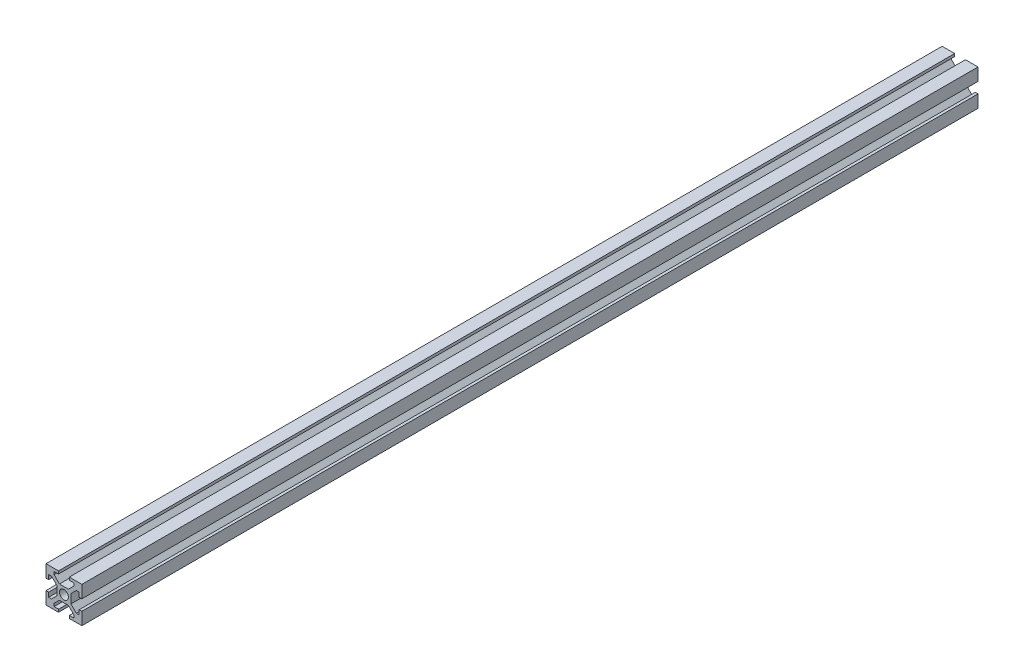
from build123d import *

# Parameters (mm, degrees)
SKETCH1_R           = 2.5
BOSS_EXTRUDE1_DEPTH = 500


with BuildPart() as part:
    # Sketch1 → Boss-Extrude1 (new body)
    with BuildSketch(Plane.XY):
        Polygon((-10, 3), (-10, 10), (-3, 10), (-3, 8.5), (-5.5, 8.5), (-5.5, 6.914213562), (-2.5, 3.914213562), (2.5, 3.914213562), (5.5, 6.914213562), (5.5, 8.5), (3, 8.5), (3, 10), (10, 10), (10, 3), (8.5, 3), (8.5, 5.5), (6.914213562, 5.5), (3.914213562, 2.5), (3.914213562, -2.5), (6.914213562, -5.5), (8.5, -5.5), (8.5, -3), (10, -3), (10, -10), (3, -10), (3, -8.5), (5.5, -8.5), (5.5, -6.914213562), (2.5, -3.914213562), (-2.5, -3.914213562), (-5.5, -6.914213562), (-5.5, -8.5), (-3, -8.5), (-3, -10), (-10, -10), (-10, -3), (-8.5, -3), (-8.5, -5.5), (-6.914213562, -5.5), (-3.914213562, -2.5), (-3.914213562, 2.5), (-6.914213562, 5.5), (-8.5, 5.5), (-8.5, 3), align=None)
        Circle(SKETCH1_R, mode=Mode.SUBTRACT)
    extrude(amount=-BOSS_EXTRUDE1_DEPTH)


solid = part.part
